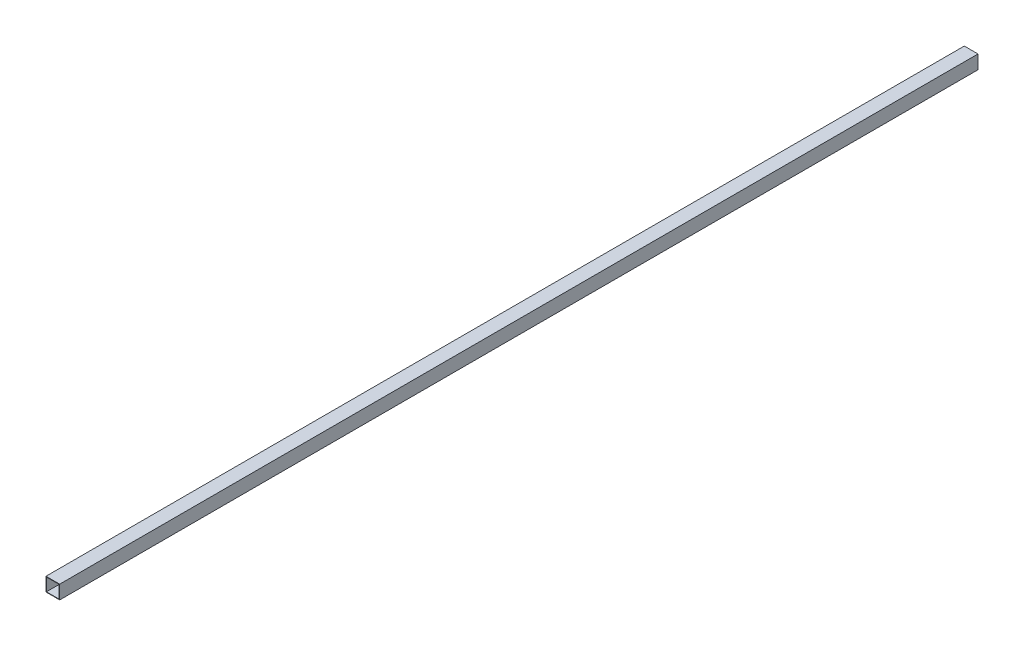
from build123d import *

# Parameters (mm, degrees)
CROQUIS1_W            = 30
CROQUIS1_H            = 30
CROQUIS1_W_2          = 28
CROQUIS1_H_2          = 28
EXTRUIR_L_MINA1_DEPTH = 1005


with BuildPart() as part:
    # Croquis1 → Extruir-Lámina1 (new, symmetric)
    with BuildSketch(Plane.XY):
        Rectangle(CROQUIS1_W, CROQUIS1_H)
        Rectangle(CROQUIS1_W_2, CROQUIS1_H_2, mode=Mode.SUBTRACT)
    extrude(amount=EXTRUIR_L_MINA1_DEPTH, both=True)


solid = part.part
